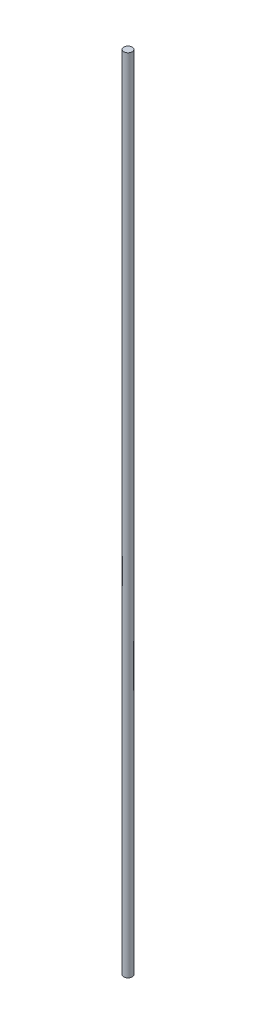
from build123d import *

# Parameters (mm, degrees)
SKETCH1_R           = 4.7625
BOSS_EXTRUDE1_DEPTH = 914.4


with BuildPart() as part:
    # Sketch1 → Boss-Extrude1 (new body)
    with BuildSketch(Plane(origin=(0, 0, 0), x_dir=(1, 0, 0), z_dir=(0, 1, 0))):
        with Locations(Location((0, 0, 0), (0, 0, 270))):
            Circle(SKETCH1_R)
    extrude(amount=BOSS_EXTRUDE1_DEPTH)


solid = part.part
